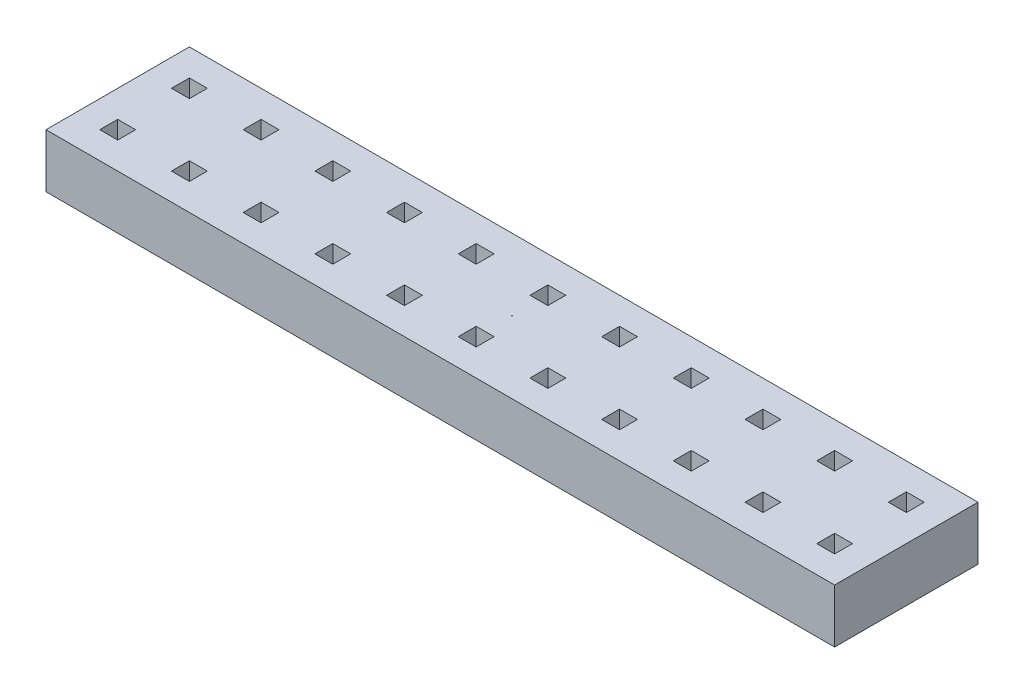
from build123d import *

# Parameters (mm, degrees)
SKETCH1_W           = 22
SKETCH1_H           = 4
BOSS_EXTRUDE1_DEPTH = 1.5
SKETCH2_W           = 0.5
SKETCH2_H           = 0.5
CUT_EXTRUDE1_DEPTH  = 2
SKETCH3_R           = 0.01
CUT_EXTRUDE2_DEPTH  = 1.5


with BuildPart() as part:
    # Sketch1 → Boss-Extrude1 (new body)
    with BuildSketch(Plane(origin=(0, 0, 0), x_dir=(1, 0, 0), z_dir=(0, 1, 0))):
        with Locations((11, 2)):
            Rectangle(SKETCH1_W, SKETCH1_H)
    extrude(amount=BOSS_EXTRUDE1_DEPTH)

    # Sketch2 → Cut-Extrude1 (cut)
    with BuildSketch(Plane(origin=(0, 1.5, 0), x_dir=(1, 0, 0), z_dir=(0, 1, 0))):
        with Locations((3, 3)):
            Rectangle(SKETCH2_W, SKETCH2_H)
        with Locations((1, 3)):
            Rectangle(SKETCH2_W, SKETCH2_H)
        with Locations((5, 3)):
            Rectangle(SKETCH2_W, SKETCH2_H)
        with Locations((7, 3)):
            Rectangle(SKETCH2_W, SKETCH2_H)
        with Locations((9, 3)):
            Rectangle(SKETCH2_W, SKETCH2_H)
        with Locations((11, 3)):
            Rectangle(SKETCH2_W, SKETCH2_H)
        with Locations((13, 3)):
            Rectangle(SKETCH2_W, SKETCH2_H)
        with Locations((15, 3)):
            Rectangle(SKETCH2_W, SKETCH2_H)
        with Locations((17, 3)):
            Rectangle(SKETCH2_W, SKETCH2_H)
        with Locations((19, 3)):
            Rectangle(SKETCH2_W, SKETCH2_H)
        with Locations((21, 3)):
            Rectangle(SKETCH2_W, SKETCH2_H)
        with Locations((1, 1)):
            Rectangle(SKETCH2_W, SKETCH2_H)
        with Locations((3, 1)):
            Rectangle(SKETCH2_W, SKETCH2_H)
        with Locations((5, 1)):
            Rectangle(SKETCH2_W, SKETCH2_H)
        with Locations((7, 1)):
            Rectangle(SKETCH2_W, SKETCH2_H)
        with Locations((9, 1)):
            Rectangle(SKETCH2_W, SKETCH2_H)
        with Locations((11, 1)):
            Rectangle(SKETCH2_W, SKETCH2_H)
        with Locations((13, 1)):
            Rectangle(SKETCH2_W, SKETCH2_H)
        with Locations((15, 1)):
            Rectangle(SKETCH2_W, SKETCH2_H)
        with Locations((17, 1)):
            Rectangle(SKETCH2_W, SKETCH2_H)
        with Locations((19, 1)):
            Rectangle(SKETCH2_W, SKETCH2_H)
        with Locations((21, 1)):
            Rectangle(SKETCH2_W, SKETCH2_H)
    extrude(amount=-CUT_EXTRUDE1_DEPTH, mode=Mode.SUBTRACT)

    # Sketch3 → Cut-Extrude2 (cut)
    with BuildSketch(Plane(origin=(0, 1.5, 0), x_dir=(1, 0, 0), z_dir=(0, 1, 0))):
        with Locations((11, 2)):
            Circle(SKETCH3_R)
    extrude(amount=-CUT_EXTRUDE2_DEPTH, mode=Mode.SUBTRACT)


solid = part.part
